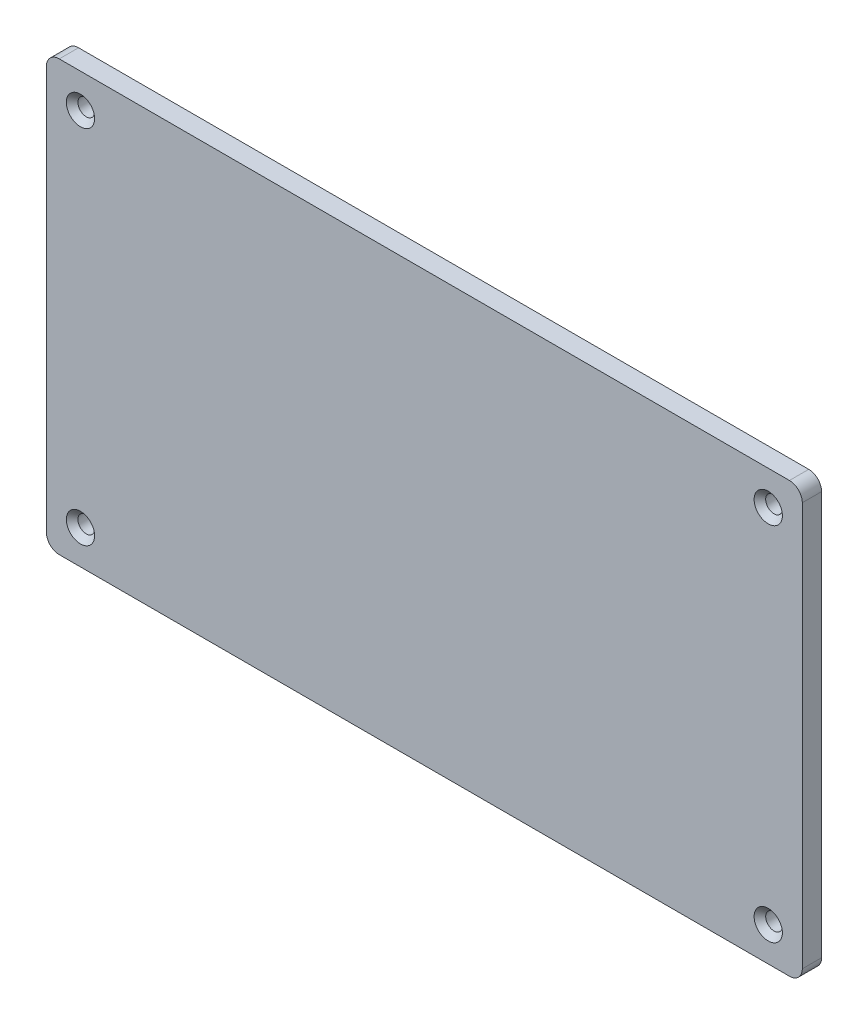
from build123d import *

# Parameters (mm, degrees)
SCHIZZO1_W                             = 117.6
SCHIZZO1_H                             = 66.8
ESTRUSIONE_ESTRUSIONE1_DEPTH           = 3
RACCORDO1_R                            = 2
RACCORDO2_R                            = 2
RACCORDO3_R                            = 2
RACCORDO4_R                            = 2
FORO_SVASATO_PER_VITE_M2_1_D           = 2.6
FORO_SVASATO_PER_VITE_M2_1_CSINK_D     = 4.4
FORO_SVASATO_PER_VITE_M2_1_CSINK_ANGLE = 90


with BuildPart() as part:
    # Schizzo1 → Estrusione-Estrusione1 (new body)
    with BuildSketch(Plane.XY):
        Rectangle(SCHIZZO1_W, SCHIZZO1_H)
    extrude(amount=ESTRUSIONE_ESTRUSIONE1_DEPTH)

    # Raccordo1
    raccordo1_edges = [part.edges().sort_by_distance(p)[0] for p in [
        (-58.8, 33.4, 1.5),
    ]]
    fillet(raccordo1_edges, radius=RACCORDO1_R)

    # Raccordo2
    raccordo2_edges = [part.edges().sort_by_distance(p)[0] for p in [
        (58.8, 33.4, 1.5),
    ]]
    fillet(raccordo2_edges, radius=RACCORDO2_R)

    # Raccordo3
    raccordo3_edges = [part.edges().sort_by_distance(p)[0] for p in [
        (58.8, -33.4, 1.5),
    ]]
    fillet(raccordo3_edges, radius=RACCORDO3_R)

    # Raccordo4
    raccordo4_edges = [part.edges().sort_by_distance(p)[0] for p in [
        (-58.8, -33.4, 1.5),
    ]]
    fillet(raccordo4_edges, radius=RACCORDO4_R)

    # Foro svasato per Vite M2-1 (through all)
    with Locations(Plane.XY.offset(3)):
        with Locations((53.5, 28.1), (-53.5, 28.1), (-53.5, -28.1), (53.5, -28.1)):
            CounterSinkHole(FORO_SVASATO_PER_VITE_M2_1_D / 2, FORO_SVASATO_PER_VITE_M2_1_CSINK_D / 2, counter_sink_angle=FORO_SVASATO_PER_VITE_M2_1_CSINK_ANGLE)


solid = part.part
